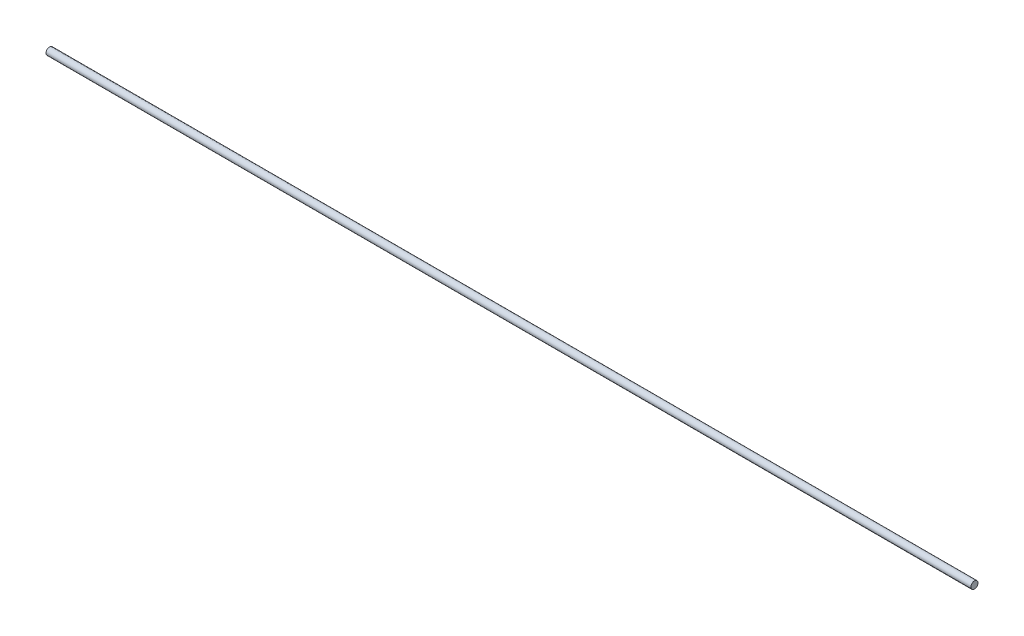
from build123d import *

# Parameters (mm, degrees)
CROQUIS1_R              = 2.5
SALIENTE_EXTRUIR1_DEPTH = 645


with BuildPart() as part:
    # Croquis1 → Saliente-Extruir1 (new body)
    with BuildSketch(Plane(origin=(0, 0, 0), x_dir=(0, 0, -1), z_dir=(1, 0, 0))):
        with Locations(Location((0, 0, 0), (0, 0, 180))):
            Circle(CROQUIS1_R)
    extrude(amount=SALIENTE_EXTRUIR1_DEPTH)


solid = part.part
